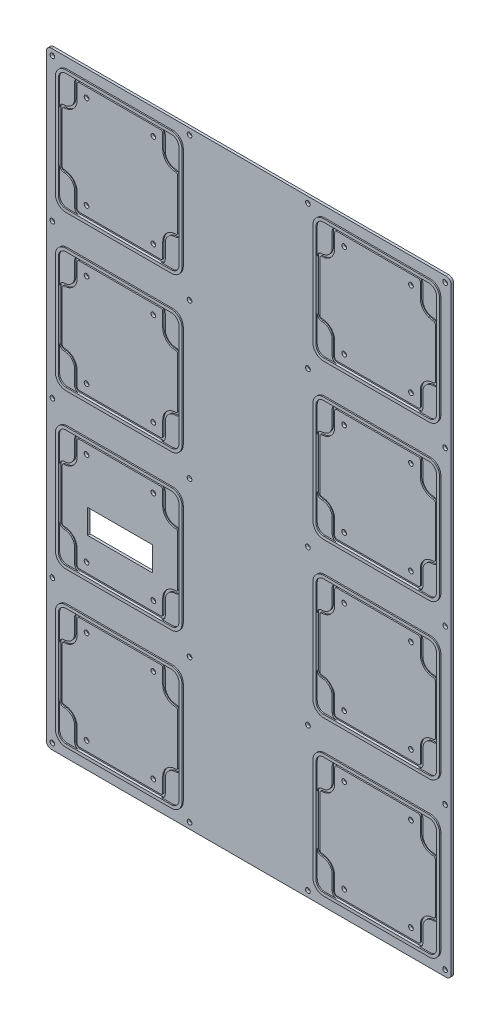
from build123d import *

# Parameters (mm, degrees)
SKETCH1_W            = 254
SKETCH1_H            = 381
BOSS_EXTRUDE1_DEPTH  = 1.5875
SKETCH2_R            = 1.4732
CUT_EXTRUDE1_DEPTH   = 458.907763809
FILLET1_R            = 3.175
CUT_EXTRUDE2_DEPTH   = 0.79375
BOSS_EXTRUDE2_DEPTH  = 0.79375
SKETCH5_R            = 1.4732
CUT_EXTRUDE3_DEPTH   = 458.907763809
LPATTERN1_COUNT      = 4
LPATTERN1_PITCH      = 96.8756
LPATTERN1_COUNT_DIR2 = 2
LPATTERN1_PITCH_DIR2 = 161.5948
SKETCH6_W            = 40.64
SKETCH6_H            = 15.24
CUT_EXTRUDE4_DEPTH   = 458.907763809


with BuildPart() as part:
    # Sketch1 → Boss-Extrude1 (new body)
    with BuildSketch(Plane.XY):
        with Locations((127, 190.5)):
            Rectangle(SKETCH1_W, SKETCH1_H)
    extrude(amount=BOSS_EXTRUDE1_DEPTH)

    # Sketch2 → Cut-Extrude1 (cut, through all)
    with BuildSketch(Plane.XY.offset(1.5875)):
        with Locations((3.81, 377.19)):
            Circle(SKETCH2_R)
        with Locations(Location((89.8652, 377.19, 0), (0, 0, 180))):
            Circle(SKETCH2_R)
        with Locations(Location((164.1348, 377.19, 0), (0, 0, 180))):
            Circle(SKETCH2_R)
        with Locations((250.19, 377.19)):
            Circle(SKETCH2_R)
        with Locations(Location((164.1348, 287.375451288, 0), (0, 0, 180))):
            Circle(SKETCH2_R)
        with Locations((3.81, 287.3756)):
            Circle(SKETCH2_R)
        with Locations((250.19, 287.3756)):
            Circle(SKETCH2_R)
        with Locations((89.8652, 287.3756)):
            Circle(SKETCH2_R)
        with Locations(Location((164.1348, 190.499990436, 0), (0, 0, 180))):
            Circle(SKETCH2_R)
        with Locations((3.81, 191.135)):
            Circle(SKETCH2_R)
        with Locations((250.19, 190.5)):
            Circle(SKETCH2_R)
        with Locations((89.8652, 190.5)):
            Circle(SKETCH2_R)
        with Locations(Location((164.1348, 93.6244, 0), (0, 0, 180))):
            Circle(SKETCH2_R)
        with Locations((3.81, 93.6244)):
            Circle(SKETCH2_R)
        with Locations((250.19, 93.6244)):
            Circle(SKETCH2_R)
        with Locations((89.8652, 93.6244)):
            Circle(SKETCH2_R)
        with Locations(Location((164.1348, 3.81, 0), (0, 0, 180))):
            Circle(SKETCH2_R)
        with Locations((3.81, 3.81)):
            Circle(SKETCH2_R)
        with Locations((250.19, 3.81)):
            Circle(SKETCH2_R)
        with Locations((89.8652, 3.81)):
            Circle(SKETCH2_R)
    extrude(amount=-CUT_EXTRUDE1_DEPTH, mode=Mode.SUBTRACT)

    # Fillet1
    fillet1_edges = [part.edges().sort_by_distance(p)[0] for p in [
        (0, 381, 0.79375),
        (254, 381, 0.79375),
        (254, 0, 0.79375),
        (0, 0, 0.79375),
    ]]
    fillet(fillet1_edges, radius=FILLET1_R)

    # Sketch3 → Cut-Extrude2 (cut)
    with BuildSketch(Plane.XY.offset(1.5875)):
        with BuildLine():
            Line((17.78, 79.1718), (17.78, 70.1802))
            ThreePointArc((17.78, 70.1802), (15.853172671, 65.528427329), (11.2014, 63.6016))
            ThreePointArc((11.2014, 63.6016), (9.207783141, 62.775816859), (8.382, 60.7822))
            Line((8.382, 60.7822), (8.382, 29.591))
            ThreePointArc((8.382, 29.591), (9.207783141, 27.597383141), (11.2014, 26.7716))
            ThreePointArc((11.2014, 26.7716), (15.853172671, 24.844772671), (17.78, 20.193))
            Line((17.78, 20.193), (17.78, 11.2014))
            ThreePointArc((17.78, 11.2014), (18.605783141, 9.207783141), (20.5994, 8.382))
            Line((20.5994, 8.382), (71.8058, 8.382))
            ThreePointArc((71.8058, 8.382), (73.799416859, 9.207783141), (74.6252, 11.2014))
            Line((74.6252, 11.2014), (74.6252, 20.193))
            ThreePointArc((74.6252, 20.193), (76.552027329, 24.844772671), (81.2038, 26.7716))
            ThreePointArc((81.2038, 26.7716), (83.197416859, 27.597383141), (84.0232, 29.591))
            Line((84.0232, 29.591), (84.0232, 60.7822))
            ThreePointArc((84.0232, 60.7822), (83.197416859, 62.775816859), (81.2038, 63.6016))
            ThreePointArc((81.2038, 63.6016), (76.552027329, 65.528427329), (74.6252, 70.1802))
            Line((74.6252, 70.1802), (74.6252, 79.1718))
            ThreePointArc((74.6252, 79.1718), (73.799416859, 81.165416859), (71.8058, 81.9912))
            Line((71.8058, 81.9912), (20.5994, 81.9912))
            ThreePointArc((20.5994, 81.9912), (18.605783141, 81.165416859), (17.78, 79.1718))
        make_face()
        with BuildLine():
            Line((82.4357, 29.591), (82.4357, 60.7822))
            ThreePointArc((82.4357, 60.7822), (82.074884844, 61.653284844), (81.2038, 62.0141))
            ThreePointArc((81.2038, 62.0141), (75.429495314, 64.405895314), (73.0377, 70.1802))
            Line((73.0377, 70.1802), (73.0377, 79.1718))
            ThreePointArc((73.0377, 79.1718), (72.676884844, 80.042884844), (71.8058, 80.4037))
            Line((71.8058, 80.4037), (20.5994, 80.4037))
            ThreePointArc((20.5994, 80.4037), (19.728315156, 80.042884844), (19.3675, 79.1718))
            Line((19.3675, 79.1718), (19.3675, 70.1802))
            ThreePointArc((19.3675, 70.1802), (16.975704686, 64.405895314), (11.2014, 62.0141))
            ThreePointArc((11.2014, 62.0141), (10.330315156, 61.653284844), (9.9695, 60.7822))
            Line((9.9695, 60.7822), (9.9695, 29.591))
            ThreePointArc((9.9695, 29.591), (10.330315156, 28.719915156), (11.2014, 28.3591))
            ThreePointArc((11.2014, 28.3591), (16.975704686, 25.967304686), (19.3675, 20.193))
            Line((19.3675, 20.193), (19.3675, 11.2014))
            ThreePointArc((19.3675, 11.2014), (19.728315156, 10.330315156), (20.5994, 9.9695))
            Line((20.5994, 9.9695), (71.8058, 9.9695))
            ThreePointArc((71.8058, 9.9695), (72.676884844, 10.330315156), (73.0377, 11.2014))
            Line((73.0377, 11.2014), (73.0377, 20.193))
            ThreePointArc((73.0377, 20.193), (75.429495314, 25.967304686), (81.2038, 28.3591))
            ThreePointArc((81.2038, 28.3591), (82.074884844, 28.719915156), (82.4357, 29.591))
        make_face(mode=Mode.SUBTRACT)
    cut_extrude2 = extrude(amount=-CUT_EXTRUDE2_DEPTH, mode=Mode.SUBTRACT)

    # Sketch4 → Boss-Extrude2 (add)
    with BuildSketch(Plane.XY.offset(1.5875)):
        with BuildLine():
            Line((6.477, 60.7822), (6.477, 77.2287))
            ThreePointArc((6.477, 77.2287), (8.429865536, 81.943334464), (13.1445, 83.8962))
            Line((13.1445, 83.8962), (20.5994, 83.8962))
            Line((20.5994, 83.8962), (79.2607, 83.8962))
            ThreePointArc((79.2607, 83.8962), (83.975334464, 81.943334464), (85.9282, 77.2287))
            Line((85.9282, 77.2287), (85.9282, 13.1445))
            ThreePointArc((85.9282, 13.1445), (83.975334464, 8.429865536), (79.2607, 6.477))
            Line((79.2607, 6.477), (13.1445, 6.477))
            ThreePointArc((13.1445, 6.477), (8.429865536, 8.429865536), (6.477, 13.1445))
            Line((6.477, 13.1445), (6.477, 60.7822))
        make_face()
        with BuildLine():
            Line((8.382, 60.7822), (8.382, 77.2287))
            ThreePointArc((8.382, 77.2287), (9.776903955, 80.596296045), (13.1445, 81.9912))
            Line((13.1445, 81.9912), (20.5994, 81.9912))
            Line((20.5994, 81.9912), (79.2607, 81.9912))
            ThreePointArc((79.2607, 81.9912), (82.628296045, 80.596296045), (84.0232, 77.2287))
            Line((84.0232, 77.2287), (84.0232, 13.1445))
            ThreePointArc((84.0232, 13.1445), (82.628296045, 9.776903955), (79.2607, 8.382))
            Line((79.2607, 8.382), (13.1445, 8.382))
            ThreePointArc((13.1445, 8.382), (9.776903955, 9.776903955), (8.382, 13.1445))
            Line((8.382, 13.1445), (8.382, 60.7822))
        make_face(mode=Mode.SUBTRACT)
    boss_extrude2 = extrude(amount=BOSS_EXTRUDE2_DEPTH)

    # Sketch5 → Cut-Extrude3 (cut, through all)
    with BuildSketch(Plane.XY.offset(1.5875)):
        with Locations((25.2476, 74.3966)):
            Circle(SKETCH5_R)
        with Locations(Location((67.1576, 74.3966, 0), (0, 0, 180))):
            Circle(SKETCH5_R)
        with Locations((67.1576, 15.9766)):
            Circle(SKETCH5_R)
        with Locations(Location((25.2476, 15.9766, 0), (0, 0, 180))):
            Circle(SKETCH5_R)
    cut_extrude3 = extrude(amount=-CUT_EXTRUDE3_DEPTH, mode=Mode.SUBTRACT)

    # LPattern1: Cut-Extrude2, Boss-Extrude2, Cut-Extrude3 4 × 2
    with Locations(*[(j * LPATTERN1_PITCH_DIR2, i * LPATTERN1_PITCH, 0) for i in range(LPATTERN1_COUNT) for j in range(LPATTERN1_COUNT_DIR2) if (i, j) != (0, 0)]):
        add(cut_extrude2, mode=Mode.SUBTRACT)
        add(boss_extrude2)
        add(cut_extrude3, mode=Mode.SUBTRACT)

    # Sketch6 → Cut-Extrude4 (cut, through all)
    with BuildSketch(Plane.XY.offset(1.5875)):
        with Locations((46.2026, 135.255)):
            Rectangle(SKETCH6_W, SKETCH6_H)
    extrude(amount=-CUT_EXTRUDE4_DEPTH, mode=Mode.SUBTRACT)


solid = part.part
